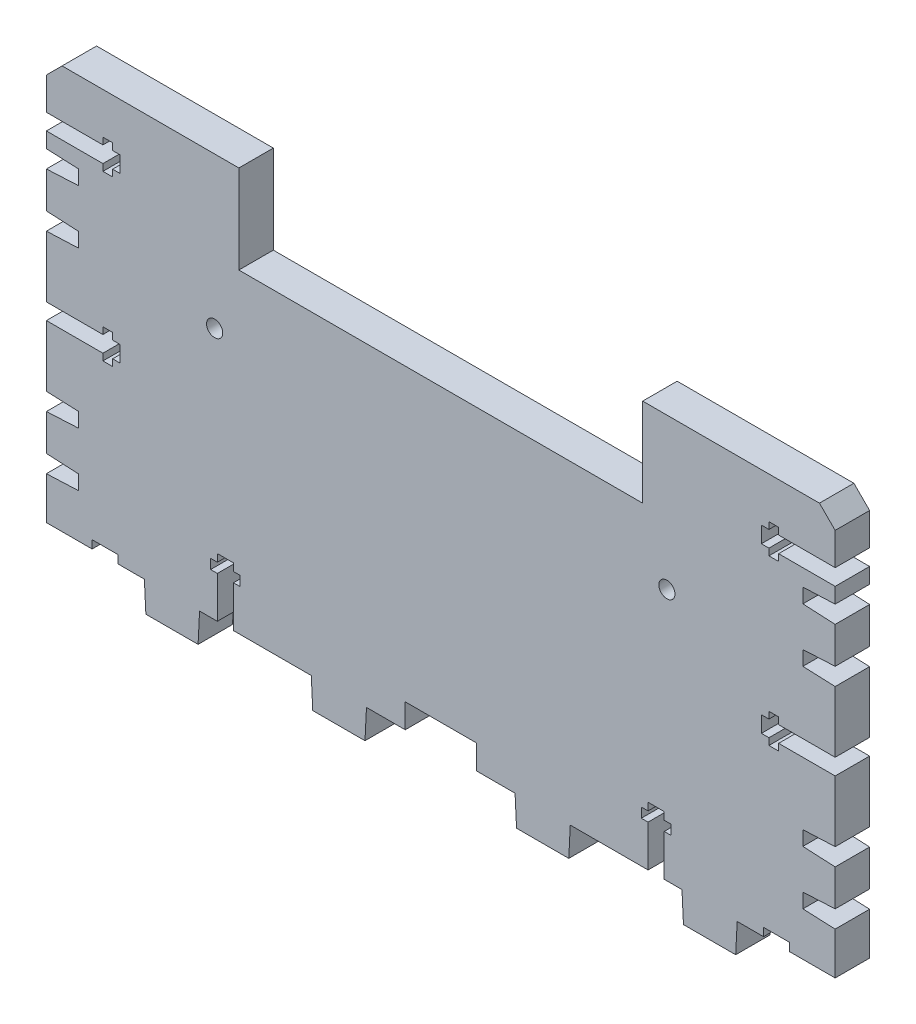
from build123d import *

# Parameters (mm, degrees)
SKETCH2_R           = 1.5
BOSS_EXTRUDE1_DEPTH = 6.4


with BuildPart() as part:
    # Sketch2 → Boss-Extrude1 (new body)
    with BuildSketch(Plane.XY):
        Polygon((35.75, 58.5), (110.75, 58.5), (110.75, 74.92), (143.58, 74.92), (146.5, 72), (146.5, 65.999038761), (136, 65.999038761), (136, 67.249038761), (134.2, 67.249038761), (134.2, 65.999038761), (132.8, 65.999038761), (132.8, 62.999320414), (134.2, 62.999320414), (134.2, 61.749320414), (136, 61.749320414), (136, 62.999320414), (146.5, 62.999320414), (146.5, 60.13073157), (140.5, 59.88073157), (140.5, 57.18073157), (146.5, 56.88073157), (146.5, 50.13073157), (140.5, 49.83073157), (140.5, 47.13073157), (146.5, 46.88073157), (146.5, 35.499320414), (136, 35.499320414), (136, 36.749320414), (134.2, 36.749320414), (134.2, 35.499320414), (132.8, 35.499320414), (132.8, 32.499602067), (134.2, 32.499602067), (134.2, 31.249602067), (136, 31.249602067), (136, 32.499602067), (146.5, 32.499602067), (146.5, 21.11926843), (140.5, 20.86926843), (140.5, 18.16926843), (146.5, 17.86926843), (146.5, 11.11926843), (140.5, 10.81926843), (140.5, 8.11926843), (146.5, 7.86926843), (146.5, 0), (138, 0), (138, 1.5), (133.2, 1.5), (133.2, 0), (128.3, 0), (128.025, -5.5), (118.325, -5.5), (118.05, 0), (114.75, 0), (114.75, 7.7), (116, 7.7), (116, 9.5), (114.75, 9.5), (114.75, 10.9), (111.750281653, 10.9), (111.750281653, 9.5), (110.500281653, 9.5), (110.500281653, 7.7), (111.750281653, 7.7), (111.750281653, 0), (97.3, 0), (97.025, -5.5), (87.325, -5.5), (87.05, 0), (79.85, 0), (79.85, 4.5), (66.65, 4.5), (66.65, 0), (59.45, 0), (59.175, -5.5), (49.475, -5.5), (49.2, 0), (34.749718347, 0), (34.749718347, 7.7), (35.999718347, 7.7), (35.999718347, 9.5), (34.749718347, 9.5), (34.749718347, 10.9), (31.75, 10.9), (31.75, 9.5), (30.5, 9.5), (30.5, 7.7), (31.75, 7.7), (31.75, 0), (28.45, 0), (28.175, -5.5), (18.475, -5.5), (18.2, 0), (13.3, 0), (13.3, 1.5), (8.5, 1.5), (8.5, 0), (0, 0), (0, 7.86926843), (6, 8.11926843), (6, 10.81926843), (0, 11.11926843), (0, 17.86926843), (6, 18.16926843), (6, 20.86926843), (0, 21.11926843), (0, 32.499602067), (10.5, 32.499602067), (10.5, 31.249602067), (12.3, 31.249602067), (12.3, 32.499602067), (13.7, 32.499602067), (13.7, 35.499320414), (12.3, 35.499320414), (12.3, 36.749320414), (10.5, 36.749320414), (10.5, 35.499320414), (0, 35.499320414), (0, 46.88073157), (6, 47.13073157), (6, 49.83073157), (0, 50.13073157), (0, 56.88073157), (6, 57.18073157), (6, 59.88073157), (0, 60.13073157), (0, 62.999320414), (10.5, 62.999320414), (10.5, 61.749320414), (12.3, 61.749320414), (12.3, 62.999320414), (13.7, 62.999320414), (13.7, 65.999038761), (12.3, 65.999038761), (12.3, 67.249038761), (10.5, 67.249038761), (10.5, 65.999038761), (0, 65.999038761), (0, 72), (2.92, 74.92), (35.75, 74.92), align=None)
        with Locations((31.25, 46.866359173)):
            Circle(SKETCH2_R, mode=Mode.SUBTRACT)
        with Locations(Location((115.25, 46.866359173, 0), (0, 0, 180))):
            Circle(SKETCH2_R, mode=Mode.SUBTRACT)
    extrude(amount=BOSS_EXTRUDE1_DEPTH)


solid = part.part
